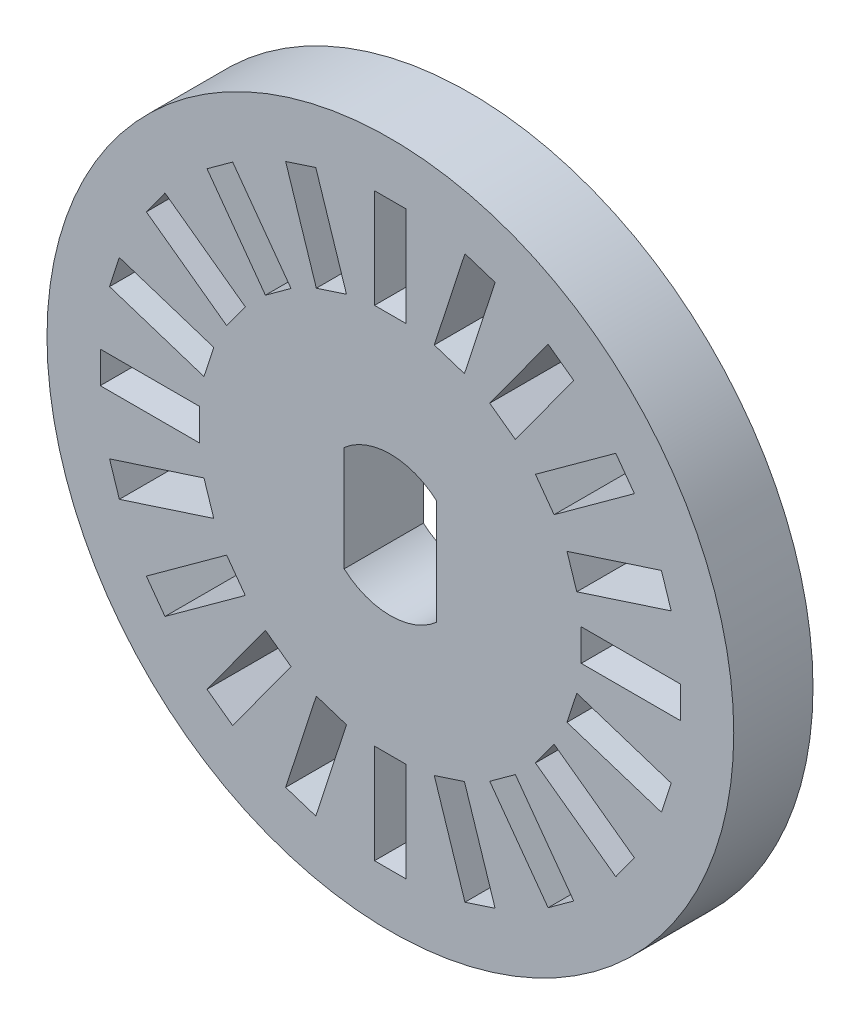
from build123d import *

# Parameters (mm, degrees)
SKETCH1_R           = 13
SKETCH1_R_2         = 2.65
BOSS_EXTRUDE1_DEPTH = 3
SKETCH2_W           = 1.2
SKETCH2_H           = 3.758494417
CUT_EXTRUDE1_DEPTH  = 19.62793601
CIRPATTERN1_COUNT   = 20


with BuildPart() as part:
    # Sketch1 → Boss-Extrude1 (new body)
    # profile 1 of 3: a face of its own
    with BuildSketch(Plane.XY):
        Circle(SKETCH1_R)
        Circle(SKETCH1_R_2, mode=Mode.SUBTRACT)
    # profile 2 of 3: a face of its own
    with BuildSketch(Plane.XY):
        with BuildLine():
            Line((-1.75, -1.989974874), (-1.75, 1.989974874))
            ThreePointArc((-1.75, 1.989974874), (-2.65, 0), (-1.75, -1.989974874))
        make_face()
    # profile 3 of 3: a face of its own
    with BuildSketch(Plane.XY):
        with BuildLine():
            ThreePointArc((2.65, 0), (2.414539294, 1.092016483), (1.75, 1.989974874))
            Line((1.75, 1.989974874), (1.75, -1.989974874))
            ThreePointArc((1.75, -1.989974874), (2.414539294, -1.092016483), (2.65, 0))
        make_face()
    extrude(amount=BOSS_EXTRUDE1_DEPTH)

    # Sketch2 → Cut-Extrude1 (cut, through all)
    with BuildSketch(Plane.XY.offset(3)):
        with Locations((0, 9.104376966)):
            Rectangle(SKETCH2_W, SKETCH2_H)
    cut_extrude1 = extrude(amount=-CUT_EXTRUDE1_DEPTH, mode=Mode.SUBTRACT)

    # CirPattern1: Cut-Extrude1 ×20 about axis
    cirpattern1_axis = Axis((0, 0, 0), (0, 0, 1))
    for i in range(1, CIRPATTERN1_COUNT):
        add(cut_extrude1.rotate(cirpattern1_axis, i * 360 / CIRPATTERN1_COUNT), mode=Mode.SUBTRACT)


solid = part.part
